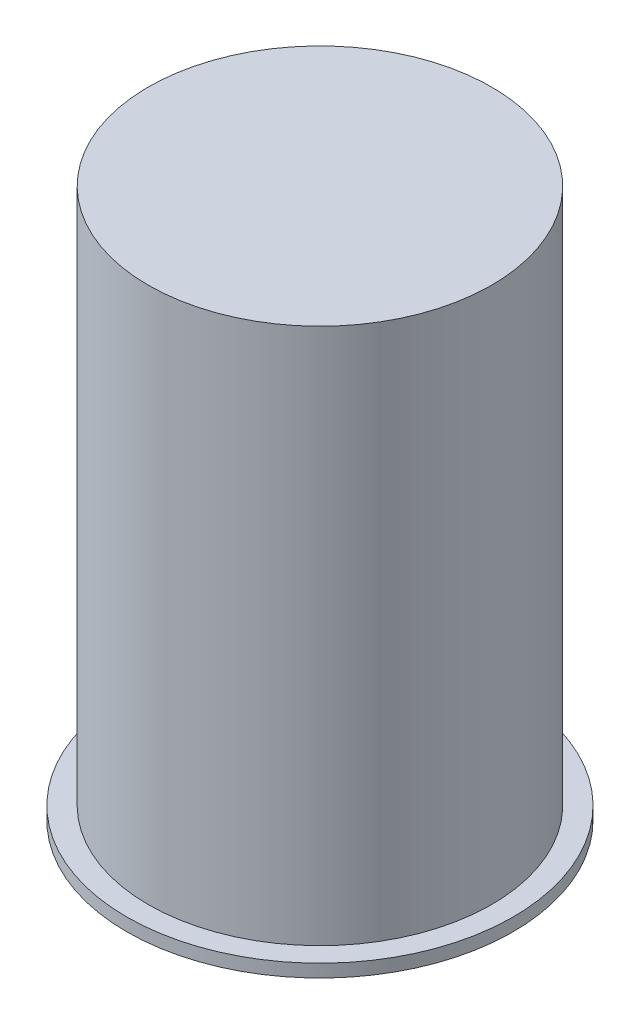
from build123d import *

# Parameters (mm, degrees)
SKETCH1_R           = 4.5
BOSS_EXTRUDE1_DEPTH = 0.3
DOME1_FACE_RADIUS   = 4.5
DOME1_HEIGHT        = 1
SKETCH2_R           = 4
BOSS_EXTRUDE2_DEPTH = 12.5


with BuildPart() as part:
    # Sketch1 → Boss-Extrude1 (new body)
    with BuildSketch(Plane(origin=(0, 0, 0), x_dir=(1, 0, 0), z_dir=(0, 1, 0))):
        with Locations(Location((0, 0, 0), (0, 0, 270))):
            Circle(SKETCH1_R)
    extrude(amount=BOSS_EXTRUDE1_DEPTH)

    # Dome1: a dome of height H over a round flat face of radius A is a cap of a sphere of radius (A * A + H * H) / (2 * H)
    dome1_r = (DOME1_FACE_RADIUS * DOME1_FACE_RADIUS + DOME1_HEIGHT * DOME1_HEIGHT) / (2 * DOME1_HEIGHT)
    dome1_base = Plane((0, 0, 0), z_dir=(0, -1, 0))
    with Locations(dome1_base.offset(DOME1_HEIGHT - dome1_r)):
        dome1_ball = Sphere(dome1_r, mode=Mode.PRIVATE)
    add(split(dome1_ball, bisect_by=dome1_base, keep=Keep.TOP, mode=Mode.PRIVATE))

    # Sketch2 → Boss-Extrude2 (add)
    with BuildSketch(Plane(origin=(0, 0.3, 0), x_dir=(1, 0, 0), z_dir=(0, 1, 0))):
        with Locations(Location((0, 0, 0), (0, 0, 270))):
            Circle(SKETCH2_R)
    extrude(amount=BOSS_EXTRUDE2_DEPTH)


solid = part.part
